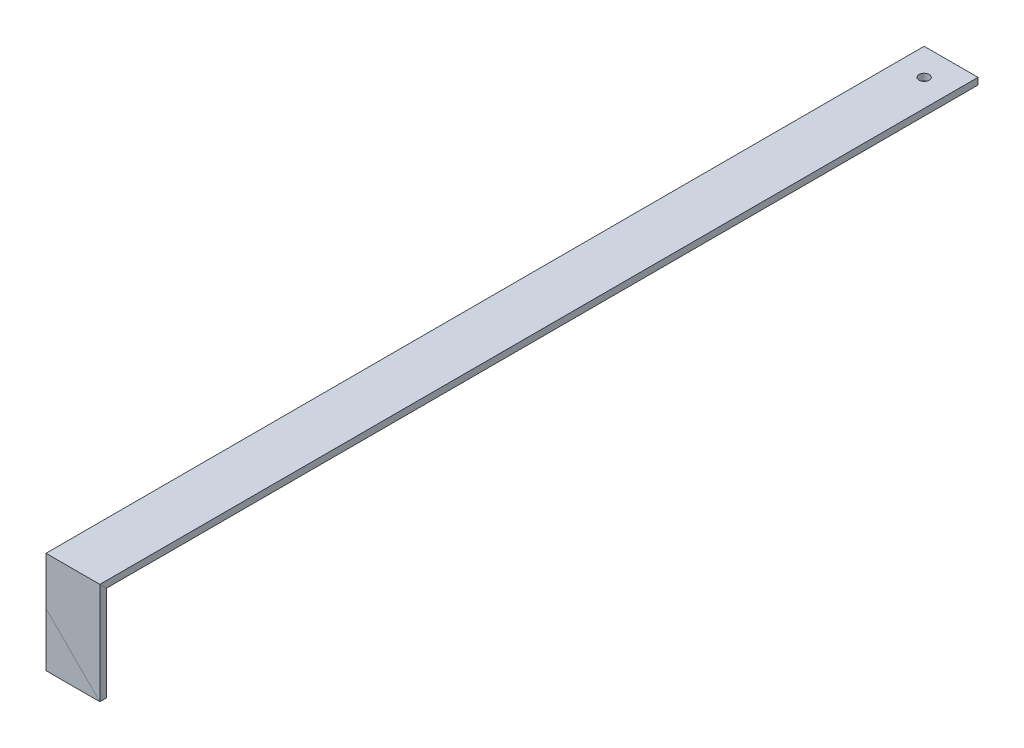
from build123d import *

# Parameters (mm, degrees)
CROQUIS1_W            = 50.8
CROQUIS1_H            = 6.31
CROQUIS2_R            = 6.5
CORTAR_EXTRUIR1_DEPTH = 10
CROQUIS5_R            = 6.5
CORTAR_EXTRUIR4_DEPTH = 10
CROQUIS7_W            = 59.2
CROQUIS7_H            = 50.8
CORTAR_EXTRUIR5_DEPTH = 6.31
CROQUIS9_W            = 50.8
CROQUIS9_H            = 66.2
CORTAR_EXTRUIR7_DEPTH = 10
CROQUIS10_R           = 4.7625
CORTAR_EXTRUIR8_DEPTH = 10


with BuildPart() as part:
    # Barrer1: sweep along a curve in space
    with BuildLine() as barrer1_path:
        Line((0, 0, 0), (0, 0, 891.73))
        Line((0, 0, 891.73), (0, -67.38, 891.73))
        Line((0, -67.38, 891.73), (-84.6, -67.38, 891.73))
    # Croquis1 → Barrer1 (sweep)
    with BuildSketch(Plane.XY):
        Rectangle(CROQUIS1_W, CROQUIS1_H)
    sweep(path=barrer1_path.line, transition=Transition.RIGHT)

    # Croquis2 → Cortar-Extruir1 (cut)
    with BuildSketch(Plane(origin=(0, 3.155, 0), x_dir=(1, 0, 0), z_dir=(0, 1, 0))):
        with Locations(Location((0, -16.5, 0), (0, 0, 270))):
            Circle(CROQUIS2_R)
        with Locations(Location((0, -47.5, 0), (0, 0, 270))):
            Circle(CROQUIS2_R)
    extrude(amount=-CORTAR_EXTRUIR1_DEPTH, mode=Mode.SUBTRACT)

    # Croquis5 → Cortar-Extruir4 (cut)
    with BuildSketch(Plane(origin=(0, 0, 888.575), x_dir=(-1, 0, 0), z_dir=(0, 0, -1))):
        with Locations((60, -67.38)):
            Circle(CROQUIS5_R)
    extrude(amount=-CORTAR_EXTRUIR4_DEPTH, mode=Mode.SUBTRACT)

    # Croquis7 → Cortar-Extruir5 (cut)
    with BuildSketch(Plane(origin=(0, 0, 888.575), x_dir=(-1, 0, 0), z_dir=(0, 0, -1))):
        with Locations((55, -67.38)):
            Rectangle(CROQUIS7_W, CROQUIS7_H)
    extrude(amount=-CORTAR_EXTRUIR5_DEPTH, mode=Mode.SUBTRACT)

    # Croquis9 → Cortar-Extruir7 (cut)
    with BuildSketch(Plane(origin=(0, 3.155, 0), x_dir=(1, 0, 0), z_dir=(0, 1, 0))):
        with Locations((0, -33.1)):
            Rectangle(CROQUIS9_W, CROQUIS9_H)
    extrude(amount=-CORTAR_EXTRUIR7_DEPTH, mode=Mode.SUBTRACT)

    # Croquis10 → Cortar-Extruir8 (cut)
    with BuildSketch(Plane(origin=(0, 3.155, 0), x_dir=(1, 0, 0), z_dir=(0, 1, 0))):
        with Locations(Location((0, -91.6, 0), (0, 0, 270))):
            Circle(CROQUIS10_R)
    extrude(amount=-CORTAR_EXTRUIR8_DEPTH, mode=Mode.SUBTRACT)


solid = part.part
